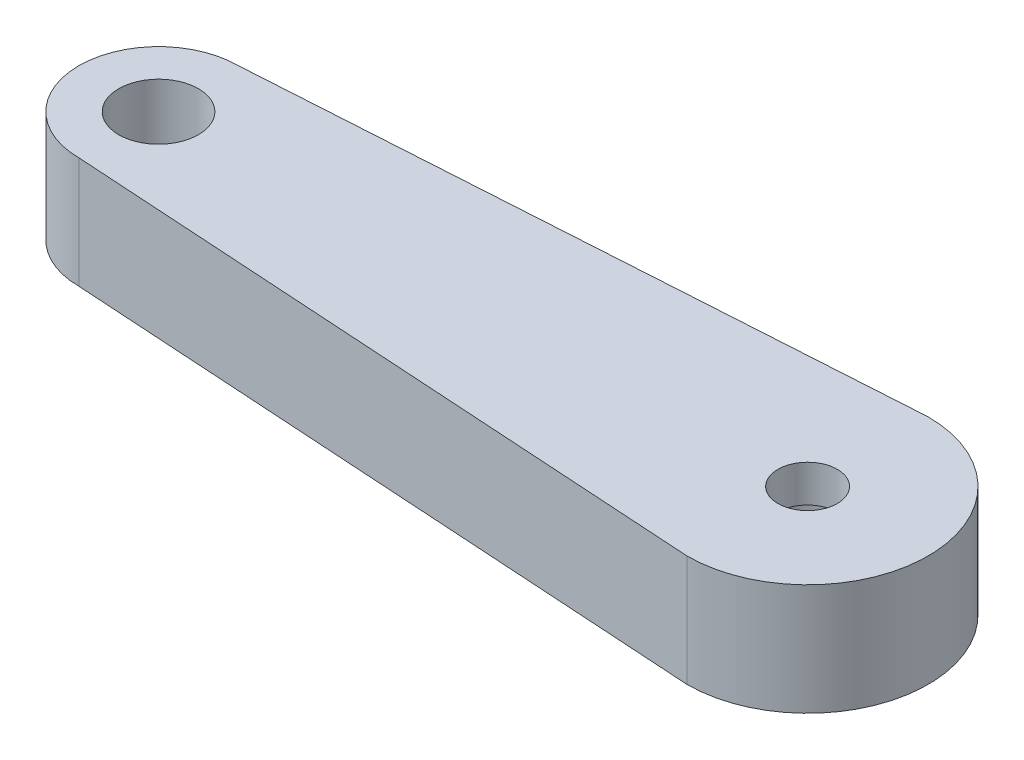
from build123d import *

# Parameters (mm, degrees)
BOSS_EXTRUDE1_DEPTH = 6
SKETCH2_R           = 2.15
CUT_EXTRUDE1_DEPTH  = 6
SKETCH3_R           = 2.95
CUT_EXTRUDE2_DEPTH  = 4
SKETCH4_R           = 1.6
CUT_EXTRUDE3_DEPTH  = 11


with BuildPart() as part:
    # Sketch1 → Boss-Extrude1 (new body)
    with BuildSketch(Plane(origin=(0, 0, 0), x_dir=(1, 0, 0), z_dir=(0, 1, 0))):
        with BuildLine():
            Line((-35, 4.3), (0, 6.5))
            ThreePointArc((0, 6.5), (6.5, 0), (0, -6.5))
            Line((0, -6.5), (-35, -4.3))
            ThreePointArc((-35, -4.3), (-39.3, 0), (-35, 4.3))
        make_face()
    extrude(amount=BOSS_EXTRUDE1_DEPTH)

    # Sketch2 → Cut-Extrude1 (cut)
    with BuildSketch(Plane(origin=(0, 0, 0), x_dir=(1, 0, 0), z_dir=(0, 1, 0))):
        with Locations(Location((-35, 0, 0), (0, 0, 270))):
            Circle(SKETCH2_R)
    extrude(amount=CUT_EXTRUDE1_DEPTH, mode=Mode.SUBTRACT)

    # Sketch3 → Cut-Extrude2 (cut)
    with BuildSketch(Plane(origin=(0, 0, 0), x_dir=(1, 0, 0), z_dir=(0, 1, 0))):
        with Locations(Location((0, 0, 0), (0, 0, 270))):
            Circle(SKETCH3_R)
    extrude(amount=CUT_EXTRUDE2_DEPTH, mode=Mode.SUBTRACT)

    # Sketch4 → Cut-Extrude3 (cut)
    with BuildSketch(Plane(origin=(0, 0, 0), x_dir=(1, 0, 0), z_dir=(0, 1, 0))):
        with Locations(Location((0, 0, 0), (0, 0, 270))):
            Circle(SKETCH4_R)
    extrude(amount=CUT_EXTRUDE3_DEPTH, mode=Mode.SUBTRACT)


solid = part.part
